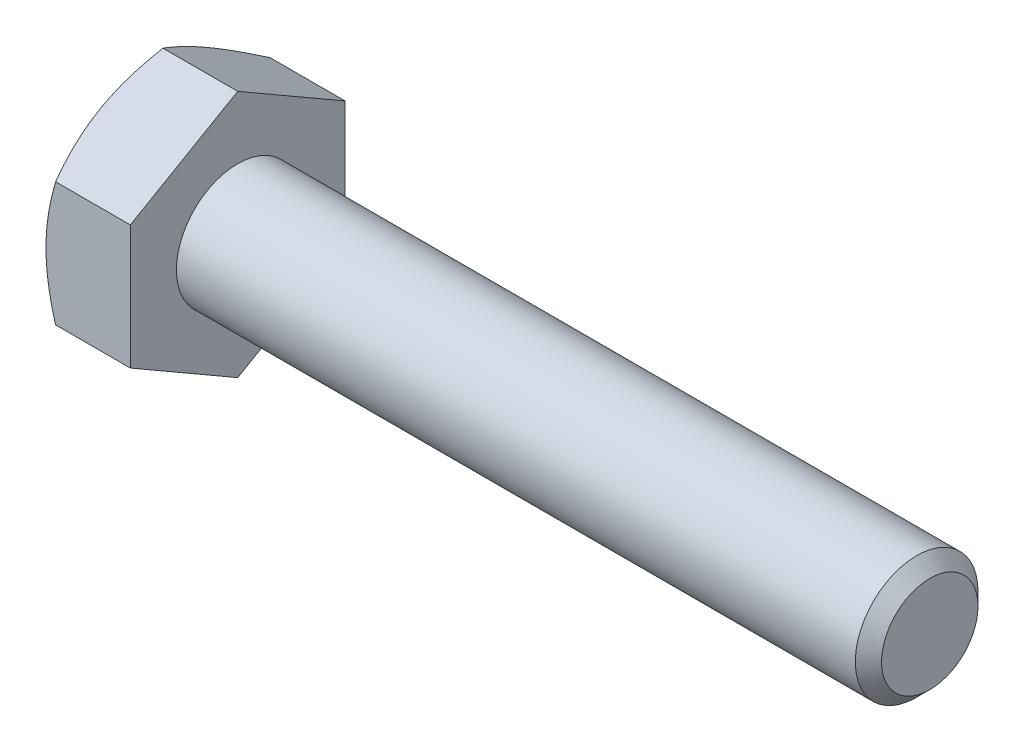
from build123d import *

# Parameters (mm, degrees)
SKETCH5_R           = 3.175
BOSS_EXTRUDE3_DEPTH = 35.814
CHAMFER1_SIZE       = 0.680357143
BOSS_EXTRUDE4_DEPTH = 4.365625
SKETCH8_OUTSIDE_W   = 167.558
SKETCH8_OUTSIDE_H   = 169.278
SKETCH8_OUTSIDE_R   = 5.55625
CUT_EXTRUDE3_DEPTH  = 42.066248079
CUT_EXTRUDE3_DRAFT  = -60


with BuildPart() as part:
    # Sketch5 → Boss-Extrude3 (new body)
    with BuildSketch(Plane(origin=(20.0898125, 0, 0), x_dir=(0, 0, -1), z_dir=(1, 0, 0))):
        Circle(SKETCH5_R)
    extrude(amount=-BOSS_EXTRUDE3_DEPTH)

    # Chamfer1
    chamfer1_edges = [part.edges().sort_by_distance(p)[0] for p in [
        (20.0898125, 0, 3.175),
    ]]
    chamfer(chamfer1_edges, length=CHAMFER1_SIZE)

    # Sketch6 → Boss-Extrude4 (add)
    with BuildSketch(Plane.ZY.offset(15.7241875)):
        Polygon((5.55625, 3.207902433), (0, 6.415804866), (-5.55625, 3.207902433), (-5.55625, -3.207902433), (0, -6.415804866), (5.55625, -3.207902433), align=None)
    extrude(amount=BOSS_EXTRUDE4_DEPTH)


with BuildPart() as cut_extrude3_tool:
    # Sketch8 outside → Cut-Extrude3 (with draft: the straight prism first)
    with BuildSketch(Plane.ZY.offset(20.0898125)):
        Rectangle(SKETCH8_OUTSIDE_W, SKETCH8_OUTSIDE_H)
        Circle(SKETCH8_OUTSIDE_R, mode=Mode.SUBTRACT)
    extrude(amount=-CUT_EXTRUDE3_DEPTH)
    # Cut-Extrude3: the draft: its side faces are tilted about the plane it starts from
    cut_extrude3_sides = [cut_extrude3_tool.faces().sort_by_distance(p)[0] for p in [
        (0.94331154, -84.639, 0),
        (0.94331154, 0, 83.779),
        (0.94331154, 84.639, 0),
        (0.94331154, 0, -83.779),
        (0.94331154, 0, -5.55625),
    ]]
    draft(cut_extrude3_sides, Plane.ZY.offset(20.0898125), CUT_EXTRUDE3_DRAFT)


with BuildPart() as part_1:
    add(part.part)

    # Cut-Extrude3: cut by cut_extrude3_tool
    add(cut_extrude3_tool.part, mode=Mode.SUBTRACT)


solid = part_1.part
